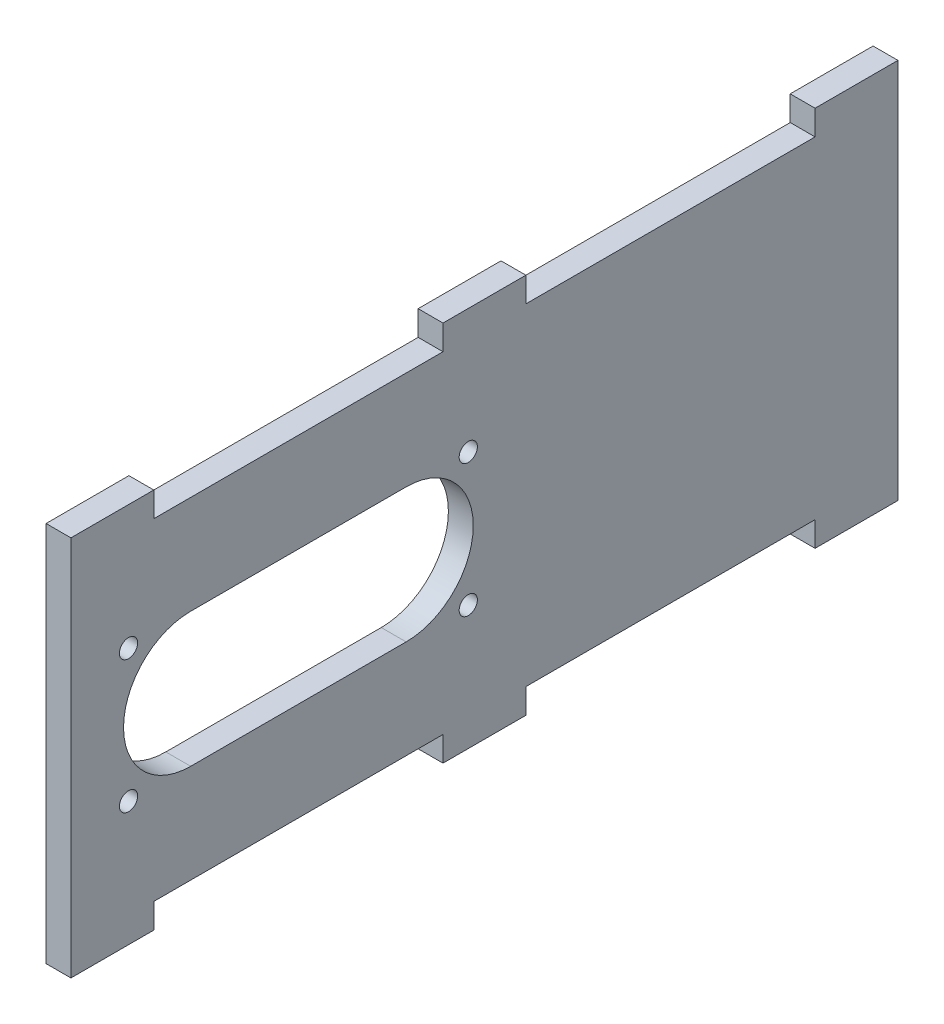
from build123d import *

# Parameters (mm, degrees)
SKETCH1_W           = 99.8
SKETCH1_H           = 40
SKETCH1_W_2         = 10
SKETCH1_H_2         = 3
BOSS_EXTRUDE1_DEPTH = 3
SKETCH2_R           = 1.1
CUT_EXTRUDE1_DEPTH  = 76.977118266


with BuildPart() as part:
    # Sketch1 → Boss-Extrude1 (new body)
    with BuildSketch(Plane(origin=(0, 0, 0), x_dir=(0, 0, -1), z_dir=(1, 0, 0))):
        with Locations((22.45, 0)):
            Rectangle(SKETCH1_W, SKETCH1_H)
        with Locations((-22.45, 21.5)):
            Rectangle(SKETCH1_W_2, SKETCH1_H_2)
        with Locations((22.45, 21.5)):
            Rectangle(SKETCH1_W_2, SKETCH1_H_2)
        with Locations((67.35, 21.5)):
            Rectangle(SKETCH1_W_2, SKETCH1_H_2)
        with Locations((67.35, -21.5)):
            Rectangle(SKETCH1_W_2, SKETCH1_H_2)
        with Locations((22.45, -21.5)):
            Rectangle(SKETCH1_W_2, SKETCH1_H_2)
        with Locations((-22.45, -21.5)):
            Rectangle(SKETCH1_W_2, SKETCH1_H_2)
    extrude(amount=BOSS_EXTRUDE1_DEPTH)

    # Sketch2 → Cut-Extrude1 (cut, through all)
    with BuildSketch(Plane(origin=(3, 0, 0), x_dir=(0, 0, -1), z_dir=(1, 0, 0))):
        with Locations((-20.5, 8)):
            Circle(SKETCH2_R)
        with Locations((-20.5, -8)):
            Circle(SKETCH2_R)
        with Locations((20.5, 8)):
            Circle(SKETCH2_R)
        with Locations((20.5, -8)):
            Circle(SKETCH2_R)
        with BuildLine():
            Line((-13, 8.1), (13, 8.1))
            ThreePointArc((13, 8.1), (21.1, 0), (13, -8.1))
            Line((13, -8.1), (-13, -8.1))
            ThreePointArc((-13, -8.1), (-21.1, 0), (-13, 8.1))
        make_face()
    extrude(amount=-CUT_EXTRUDE1_DEPTH, mode=Mode.SUBTRACT)


solid = part.part
